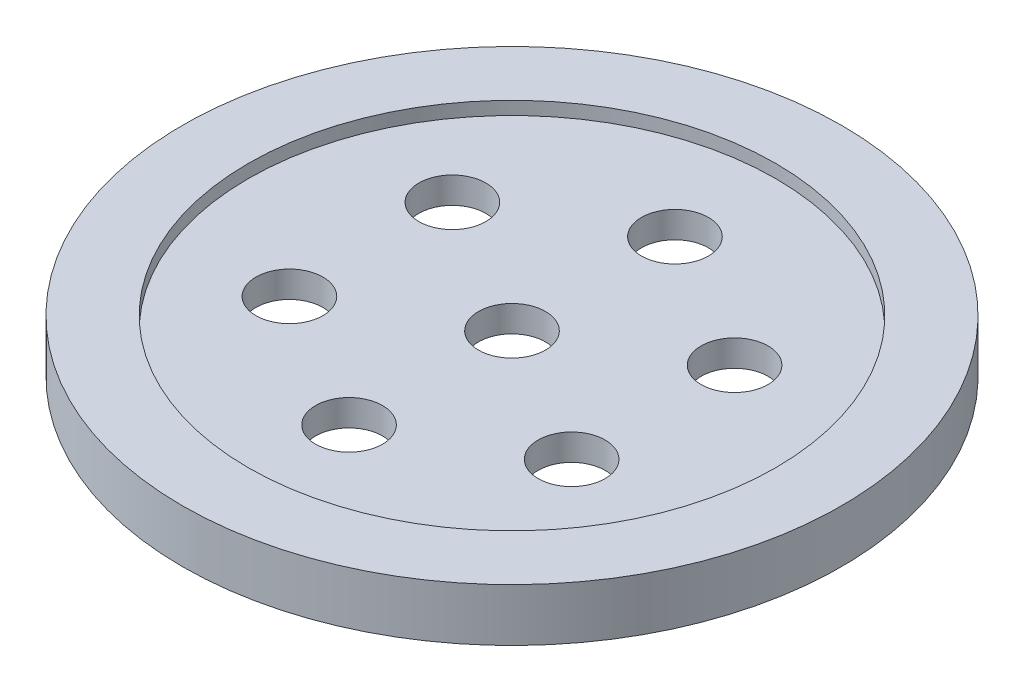
from build123d import *

# Parameters (mm, degrees)
SKETCH2_R          = 12.7
CUT_EXTRUDE1_DEPTH = 10


with BuildPart() as part:
    # Sketch1 → Revolve1 (revolve)
    with BuildSketch(Plane.XY, mode=Mode.PRIVATE) as revolve1_sk:
        Polygon((12.7, -4), (100, -4), (100, 1), (125, 1), (125, -19), (100, -19), (100, -14), (12.7, -14), align=None)
    revolve(revolve1_sk.sketch.rotate(Axis((0, 113.049804917, 0), (0, -1, 0)), 90), axis=Axis((0, 113.049804917, 0), (0, -1, 0)))

    # Sketch2 → Cut-Extrude1 (cut)
    with BuildSketch(Plane(origin=(0, -4, 0), x_dir=(1, 0, 0), z_dir=(0, 1, 0))):
        with Locations(Location((0, 61.801458798, 0), (0, 0, 270))):
            Circle(SKETCH2_R)
        with Locations(Location((53.52163331, 30.900729399, 0), (0, 0, 270))):
            Circle(SKETCH2_R)
        with Locations(Location((53.52163331, -30.900729399, 0), (0, 0, 270))):
            Circle(SKETCH2_R)
        with Locations(Location((0, -61.801458798, 0), (0, 0, 270))):
            Circle(SKETCH2_R)
        with Locations(Location((-53.52163331, -30.900729399, 0), (0, 0, 270))):
            Circle(SKETCH2_R)
        with Locations(Location((-53.52163331, 30.900729399, 0), (0, 0, 270))):
            Circle(SKETCH2_R)
    extrude(amount=-CUT_EXTRUDE1_DEPTH, mode=Mode.SUBTRACT)


solid = part.part
